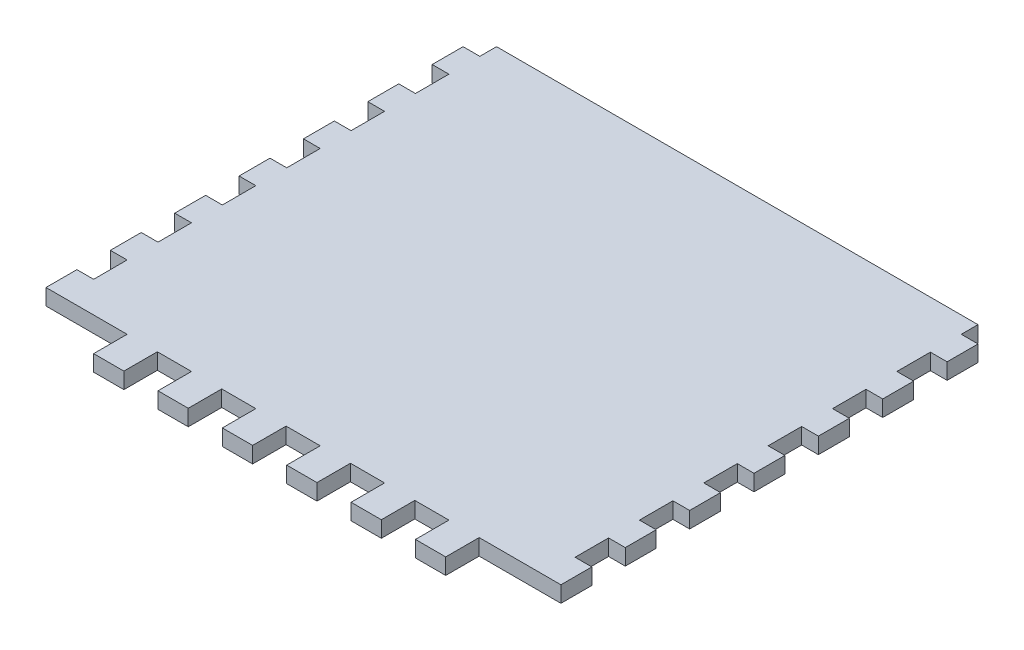
from build123d import *

# Parameters (mm, degrees)
SKETCH1_W           = 101.6
SKETCH1_H           = 107.95
BOSS_EXTRUDE1_DEPTH = 3.175
SKETCH2_W           = 3.302
SKETCH2_H           = 6.604
CUT_EXTRUDE1_DEPTH  = 75.189091179


with BuildPart() as part:
    # Sketch1 → Boss-Extrude1 (new body)
    with BuildSketch(Plane(origin=(0, 0, 0), x_dir=(1, 0, 0), z_dir=(0, 1, 0))):
        Rectangle(SKETCH1_W, SKETCH1_H)
    extrude(amount=BOSS_EXTRUDE1_DEPTH)

    # Sketch2 → Cut-Extrude1 (cut, through all)
    with BuildSketch(Plane.XZ):
        Polygon((-34.798, 31.623), (-47.498, 31.623), (-50.8, 31.623), (-50.8, 38.227), (-50.8, 53.975), (50.8, 53.975), (50.8, 38.227), (50.8, 31.623), (47.498, 31.623), (34.671, 31.623), (34.671, 38.227), (28.702, 38.227), (28.702, 31.623), (21.971, 31.623), (21.971, 38.227), (16.002, 38.227), (16.002, 31.623), (9.271, 31.623), (9.271, 38.227), (3.302, 38.227), (3.302, 31.623), (-3.429, 31.623), (-3.429, 38.227), (-9.398, 38.227), (-9.398, 31.623), (-16.129, 31.623), (-16.129, 38.227), (-22.098, 38.227), (-22.098, 31.623), (-28.829, 31.623), (-28.829, 38.227), (-34.798, 38.227), align=None)
        with Locations((49.149, 22.225)):
            Rectangle(SKETCH2_W, SKETCH2_H)
        with Locations((49.149, 9.525)):
            Rectangle(SKETCH2_W, SKETCH2_H)
        with Locations((49.149, -3.175)):
            Rectangle(SKETCH2_W, SKETCH2_H)
        with Locations((49.149, -15.875)):
            Rectangle(SKETCH2_W, SKETCH2_H)
        with Locations((49.149, -28.575)):
            Rectangle(SKETCH2_W, SKETCH2_H)
        with Locations((49.149, -41.275)):
            Rectangle(SKETCH2_W, SKETCH2_H)
        with Locations((49.149, -53.975)):
            Rectangle(SKETCH2_W, SKETCH2_H)
        with Locations((-49.149, -53.975)):
            Rectangle(SKETCH2_W, SKETCH2_H)
        with Locations((-49.149, -41.275)):
            Rectangle(SKETCH2_W, SKETCH2_H)
        with Locations((-49.149, -28.575)):
            Rectangle(SKETCH2_W, SKETCH2_H)
        with Locations((-49.149, -15.875)):
            Rectangle(SKETCH2_W, SKETCH2_H)
        with Locations((-49.149, -3.175)):
            Rectangle(SKETCH2_W, SKETCH2_H)
        with Locations((-49.149, 9.525)):
            Rectangle(SKETCH2_W, SKETCH2_H)
        with Locations((-49.149, 22.225)):
            Rectangle(SKETCH2_W, SKETCH2_H)
    extrude(amount=-CUT_EXTRUDE1_DEPTH, mode=Mode.SUBTRACT)


solid = part.part
